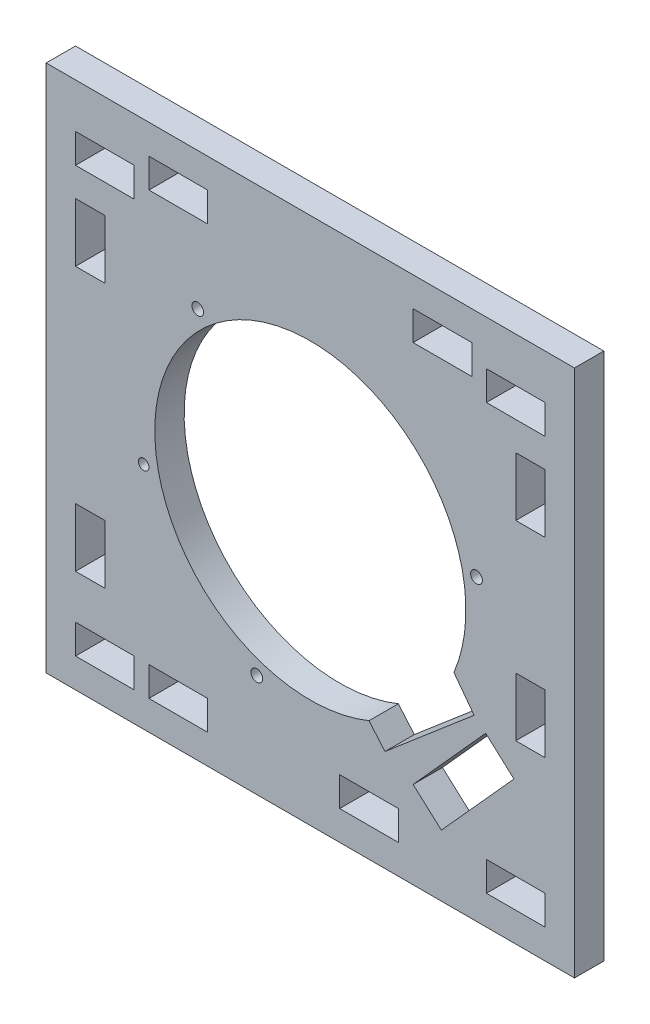
from build123d import *

# Parameters (mm, degrees)
ESQUISSE1_W        = 90
ESQUISSE1_H        = 90
ESQUISSE1_R        = 1
ESQUISSE1_R_2      = 0.9
BOSS_EXTRU_2_DEPTH = 5
ESQUISSE2_W        = 10
ESQUISSE2_H        = 5
ESQUISSE2_W_2      = 5
ESQUISSE2_H_2      = 10
CR_NEAUX_DEPTH     = 5


with BuildPart() as part:
    # Esquisse1 → Boss.-Extru.2 (new body)
    with BuildSketch(Plane.XY):
        with Locations((40, 39.6)):
            Rectangle(ESQUISSE1_W, ESQUISSE1_H)
        with Locations((20.816873759, 61.215218426)):
            Circle(ESQUISSE1_R, mode=Mode.SUBTRACT)
        with Locations((68.310891386, 45.405465436)):
            Circle(ESQUISSE1_R, mode=Mode.SUBTRACT)
        with Locations((30.872234855, 12.179316138)):
            Circle(ESQUISSE1_R, mode=Mode.SUBTRACT)
        with Locations((11.611234754, 33.677331021)):
            Circle(ESQUISSE1_R_2, mode=Mode.SUBTRACT)
        with BuildLine():
            Line((49.997987668, 15.058397717), (52.713992085, 11.870640851))
            Line((52.713992085, 11.870640851), (67.902534408, 24.811448374))
            Line((67.902534408, 24.811448374), (64.461892674, 29.40854246))
            ThreePointArc((64.461892674, 29.40854246), (21.335796244, 58.41216357), (49.997987668, 15.058397717))
        make_face(mode=Mode.SUBTRACT)
        Polygon((57.507314904, 9.408845516), (69.87315206, 23.142499017), (74.68907042, 18.806226648), (62.323233265, 5.072573147), align=None, mode=Mode.SUBTRACT)
    extrude(amount=BOSS_EXTRU_2_DEPTH)

    # Esquisse2 → Créneaux - (cut)
    with BuildSketch(Plane(origin=(0, 0, 0), x_dir=(-1, 0, 0), z_dir=(0, 0, -1))):
        with Locations((-75, 74.5)):
            Rectangle(ESQUISSE2_W, ESQUISSE2_H)
        with Locations((-5, 74.5)):
            Rectangle(ESQUISSE2_W, ESQUISSE2_H)
        with Locations((-17.5, 77.1)):
            Rectangle(ESQUISSE2_W, ESQUISSE2_H)
        with Locations((-75, 2.1)):
            Rectangle(ESQUISSE2_W, ESQUISSE2_H)
        with Locations((-5, 2.1)):
            Rectangle(ESQUISSE2_W, ESQUISSE2_H)
        with Locations((-62.5, 77.1)):
            Rectangle(ESQUISSE2_W, ESQUISSE2_H)
        with Locations((-2.5, 17.1)):
            Rectangle(ESQUISSE2_W_2, ESQUISSE2_H_2)
        with Locations((-2.5, 62.1)):
            Rectangle(ESQUISSE2_W_2, ESQUISSE2_H_2)
        with Locations((-17.5, 2.1)):
            Rectangle(ESQUISSE2_W, ESQUISSE2_H)
        with Locations((-50, 2.1)):
            Rectangle(ESQUISSE2_W, ESQUISSE2_H)
        with Locations((-77.5, 62.1)):
            Rectangle(ESQUISSE2_W_2, ESQUISSE2_H_2)
        with Locations((-77.5, 29.6)):
            Rectangle(ESQUISSE2_W_2, ESQUISSE2_H_2)
    extrude(amount=-CR_NEAUX_DEPTH, mode=Mode.SUBTRACT)


solid = part.part
